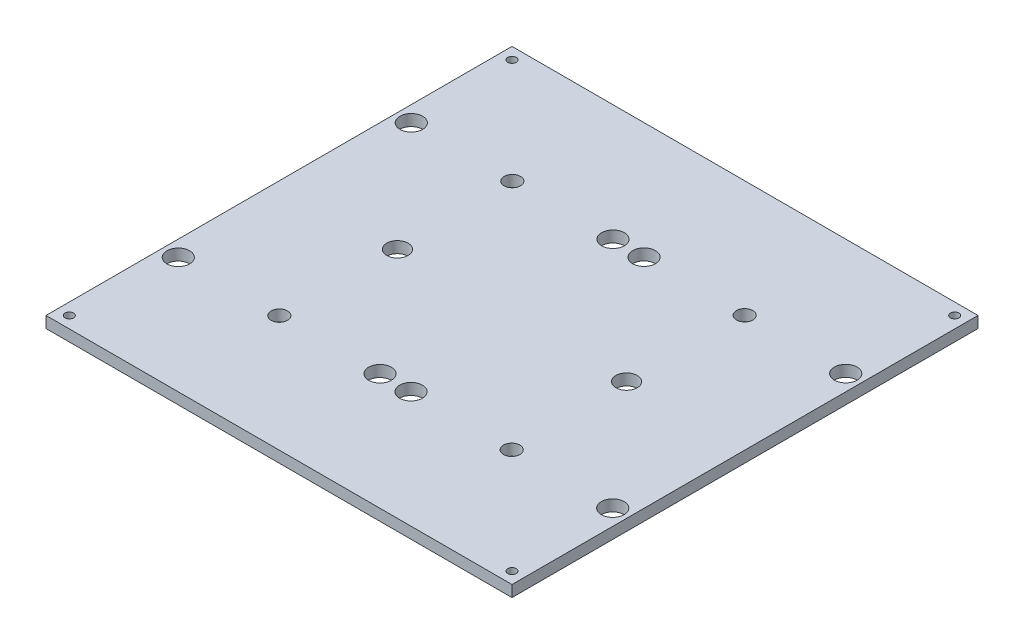
from build123d import *

# Parameters (mm, degrees)
SKETCH1_W           = 60
SKETCH1_H           = 60
SKETCH1_R           = 0.55
SKETCH1_R_2         = 1.465
SKETCH1_R_3         = 1.375
SKETCH1_R_4         = 1.055
BOSS_EXTRUDE1_DEPTH = 1.46


with BuildPart() as part:
    # Sketch1 → Boss-Extrude1 (new body)
    with BuildSketch(Plane(origin=(0, 0, 0), x_dir=(1, 0, 0), z_dir=(0, 1, 0))):
        Rectangle(SKETCH1_W, SKETCH1_H)
        with Locations(Location((-28.5, 28.5, 0), (0, 0, 270))):
            Circle(SKETCH1_R, mode=Mode.SUBTRACT)
        with Locations(Location((-27.968, 15, 0), (0, 0, 270))):
            Circle(SKETCH1_R_2, mode=Mode.SUBTRACT)
        with Locations(Location((-14.75, 0, 0), (0, 0, 270))):
            Circle(SKETCH1_R_3, mode=Mode.SUBTRACT)
        with Locations(Location((-14.960000108, 15, 0), (0, 0, 270))):
            Circle(SKETCH1_R_4, mode=Mode.SUBTRACT)
        with Locations(Location((-2, 15, 0), (0, 0, 270))):
            Circle(SKETCH1_R_2, mode=Mode.SUBTRACT)
        with Locations(Location((2, 15, 0), (0, 0, 90))):
            Circle(SKETCH1_R_2, mode=Mode.SUBTRACT)
        with Locations(Location((14.960000108, 15, 0), (0, 0, 90))):
            Circle(SKETCH1_R_4, mode=Mode.SUBTRACT)
        with Locations(Location((14.75, 0, 0), (0, 0, 90))):
            Circle(SKETCH1_R_3, mode=Mode.SUBTRACT)
        with Locations(Location((27.968, 15, 0), (0, 0, 90))):
            Circle(SKETCH1_R_2, mode=Mode.SUBTRACT)
        with Locations(Location((28.5, 28.5, 0), (0, 0, 90))):
            Circle(SKETCH1_R, mode=Mode.SUBTRACT)
        with Locations(Location((28.5, -28.5, 0), (0, 0, 270))):
            Circle(SKETCH1_R, mode=Mode.SUBTRACT)
        with Locations(Location((27.968, -15, 0), (0, 0, 270))):
            Circle(SKETCH1_R_2, mode=Mode.SUBTRACT)
        with Locations(Location((14.960000108, -15, 0), (0, 0, 270))):
            Circle(SKETCH1_R_4, mode=Mode.SUBTRACT)
        with Locations(Location((2, -15, 0), (0, 0, 270))):
            Circle(SKETCH1_R_2, mode=Mode.SUBTRACT)
        with Locations(Location((-2, -15, 0), (0, 0, 90))):
            Circle(SKETCH1_R_2, mode=Mode.SUBTRACT)
        with Locations(Location((-14.960000108, -15, 0), (0, 0, 90))):
            Circle(SKETCH1_R_4, mode=Mode.SUBTRACT)
        with Locations(Location((-27.968, -15, 0), (0, 0, 90))):
            Circle(SKETCH1_R_2, mode=Mode.SUBTRACT)
        with Locations(Location((-28.5, -28.5, 0), (0, 0, 90))):
            Circle(SKETCH1_R, mode=Mode.SUBTRACT)
    extrude(amount=BOSS_EXTRUDE1_DEPTH)


solid = part.part
